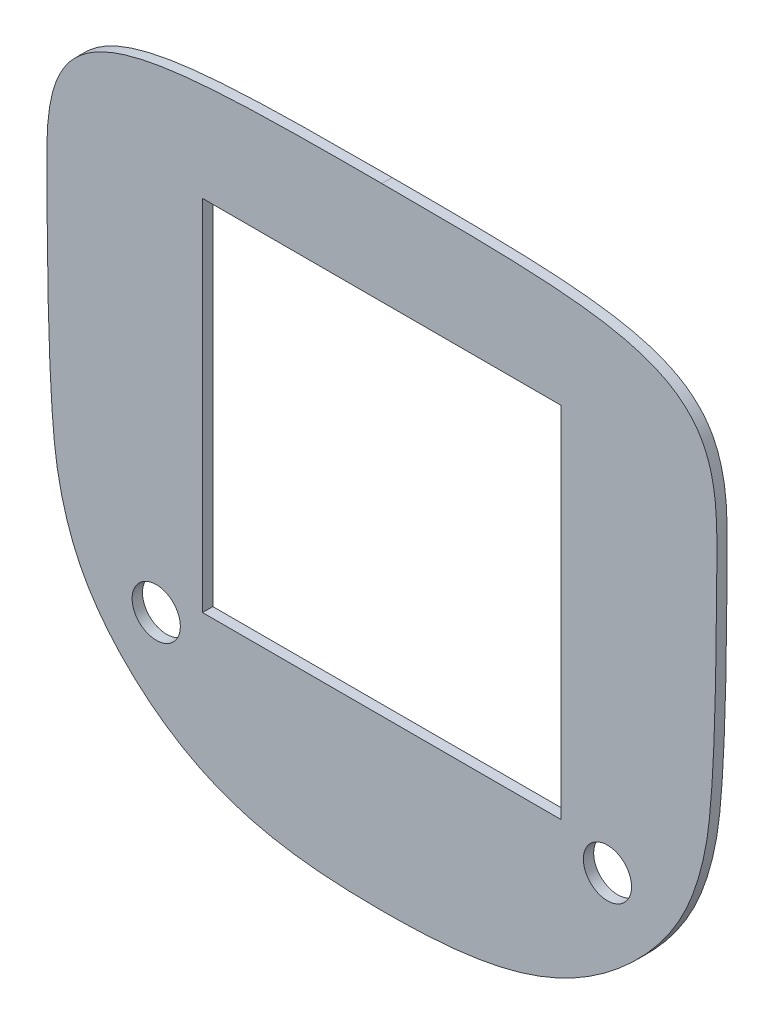
from build123d import *

# Parameters (mm, degrees)
SKETCH1_R           = 7
SKETCH1_R_2         = 7.000000001
SKETCH1_W           = 104.14
SKETCH1_H           = 104.14
BOSS_EXTRUDE1_DEPTH = 3


with BuildPart() as part:
    # Sketch1 → Boss-Extrude1 (new body)
    with BuildSketch(Plane(origin=(0, 0, 100), x_dir=(-1, 0, 0), z_dir=(0, 0, -1))):
        with BuildLine():
            add(Edge.make_bspline(
                [(-1e-09, -73.137085013), (-3.370733736, -73.137085013), (-6.734378943, -73.083771669), (-13.440672959, -72.819229501), (-16.783433063, -72.608837747), (-23.439182049, -71.964142651), (-26.752144152, -71.529637912), (-33.33759261, -70.356207321), (-36.60997649, -69.616510751), (-40.667378232, -68.443107129), (-41.477203817, -68.195980803), (-43.093366771, -67.675493026), (-43.900822122, -67.401729181), (-46.310032737, -66.541796001), (-47.889238607, -65.92044891), (-52.544477218, -63.909421833), (-55.537048564, -62.370824761), (-61.306337859, -58.908491373), (-64.084452162, -56.98724652), (-67.427542086, -54.354533899), (-68.090122652, -53.815906347), (-69.393533804, -52.722974051), (-70.035477989, -52.167844506), (-71.932790396, -50.47714376), (-73.159826692, -49.316427503), (-76.728035335, -45.734077875), (-78.958878587, -43.214525591), (-82.039575544, -39.199501195), (-83.021440244, -37.821191048), (-84.88412339, -34.974890516), (-85.767427654, -33.501005365), (-88.204559187, -29.023741799), (-89.563400092, -25.942835856), (-91.239794175, -21.190749213), (-91.74457302, -19.587205428), (-92.660442382, -16.346272129), (-93.069699195, -14.708220172), (-93.795158786, -11.398499673), (-94.111800727, -9.722957871), (-94.651697476, -6.365781752), (-94.87676845, -4.6830068), (-95.239286804, -1.309281941), (-95.39057167, 0.380376979), (-95.667624115, 3.762075486), (-95.789769063, 5.454453052), (-96.006949572, 8.841737387), (-96.101559279, 10.536683887), (-96.275518719, 13.928000585), (-96.3541526, 15.624404776), (-96.567849925, 20.713768319), (-96.680733557, 24.107568552), (-96.953354403, 34.290958559), (-97.04588188, 41.082678484), (-97.149341973, 51.270007833), (-97.178486911, 54.665842901), (-97.227652976, 59.759535712), (-97.245834664, 61.457370788), (-97.286778342, 64.853283992), (-97.310325044, 66.551469151), (-97.290358192, 69.942854821), (-97.255875699, 71.636726618), (-97.09582269, 75.017699558), (-96.972551619, 76.704971621), (-96.585320654, 80.06905822), (-96.320360567, 81.745798411), (-95.854782835, 83.831735242), (-95.754841059, 84.248415208), (-95.539629218, 85.080635775), (-95.424100672, 85.496934333), (-95.054796974, 86.733533), (-94.777904174, 87.544024069), (-93.84392333, 89.928683353), (-93.083697513, 91.456112273), (-91.917347528, 93.267482281), (-91.672560415, 93.6258059), (-91.167018785, 94.323599626), (-90.905778308, 94.663945051), (-90.097205711, 95.659890217), (-89.525112782, 96.290490077), (-88.317187597, 97.487335056), (-87.6813056, 98.053529952), (-86.682325789, 98.857229484), (-86.341828077, 99.117552429), (-85.646278974, 99.623504122), (-85.290309402, 99.869702545), (-83.492108358, 101.054683185), (-81.989735399, 101.864008562), (-78.891787842, 103.280138886), (-77.295448939, 103.885283055), (-74.849929741, 104.68215643), (-74.025694859, 104.929450071), (-72.377789623, 105.387657064), (-71.552081134, 105.599261026), (-69.070517041, 106.189836208), (-67.410275941, 106.525100239), (-64.081531041, 107.113279731), (-62.412948454, 107.365409975), (-57.397851787, 108.028626666), (-54.042298135, 108.349622004), (-47.317214164, 108.852316963), (-43.947594988, 109.033131006), (-37.200013677, 109.311610648), (-33.821984223, 109.408605309), (-27.060918817, 109.552698361), (-23.677806003, 109.599487384), (-13.530472118, 109.696626212), (-6.765261961, 109.705627481), (0, 109.705627484)],
                knots=[0, 0, 0, 0, 0.03125, 0.03125, 0.0625, 0.0625, 0.09375, 0.09375, 0.125, 0.125, 0.1328125, 0.1328125, 0.140625, 0.140625, 0.15625, 0.15625, 0.1875, 0.1875, 0.21875, 0.21875, 0.2265625, 0.2265625, 0.234375, 0.234375, 0.25, 0.25, 0.28125, 0.28125, 0.296875, 0.296875, 0.3125, 0.3125, 0.34375, 0.34375, 0.359375, 0.359375, 0.375, 0.375, 0.390625, 0.390625, 0.40625, 0.40625, 0.421875, 0.421875, 0.4375, 0.4375, 0.453125, 0.453125, 0.46875, 0.46875, 0.5, 0.5, 0.5625, 0.5625, 0.59375, 0.59375, 0.609375, 0.609375, 0.625, 0.625, 0.640625, 0.640625, 0.65625, 0.65625, 0.671875, 0.671875, 0.67578125, 0.67578125, 0.6796875, 0.6796875, 0.6875, 0.6875, 0.703125, 0.703125, 0.70703125, 0.70703125, 0.7109375, 0.7109375, 0.71875, 0.71875, 0.7265625, 0.7265625, 0.73046875, 0.73046875, 0.734375, 0.734375, 0.75, 0.75, 0.765625, 0.765625, 0.7734375, 0.7734375, 0.78125, 0.78125, 0.796875, 0.796875, 0.8125, 0.8125, 0.84375, 0.84375, 0.875, 0.875, 0.90625, 0.90625, 0.9375, 0.9375, 1, 1, 1, 1], degree=3))
            add(Edge.make_bspline(
                [(-1e-09, -73.137085013), (3.370733735, -73.137085013), (6.734378942, -73.083771669), (13.440672958, -72.819229501), (16.783433062, -72.608837747), (23.439182048, -71.964142651), (26.752144151, -71.529637912), (33.337592609, -70.356207322), (36.609976489, -69.616510752), (40.667378232, -68.44310713), (41.477203816, -68.195980803), (43.093366771, -67.675493027), (43.900822121, -67.401729181), (46.310032736, -66.541796001), (47.889238606, -65.920448911), (52.544477218, -63.909421834), (55.537048563, -62.370824761), (61.306337859, -58.908491374), (64.084452162, -56.98724652), (67.427542085, -54.3545339), (68.090122651, -53.815906348), (69.393533803, -52.722974052), (70.035477989, -52.167844506), (71.932790395, -50.47714376), (73.159826692, -49.316427504), (76.728035334, -45.734077876), (78.958878587, -43.214525592), (82.039575543, -39.199501196), (83.021440244, -37.821191049), (84.884123389, -34.974890517), (85.767427654, -33.501005366), (88.204559186, -29.0237418), (89.563400092, -25.942835857), (91.239794175, -21.190749214), (91.74457302, -19.58720543), (92.660442382, -16.34627213), (93.069699195, -14.708220173), (93.795158786, -11.398499674), (94.111800727, -9.722957872), (94.651697476, -6.365781754), (94.87676845, -4.683006801), (95.239286804, -1.309281942), (95.39057167, 0.380376978), (95.667624115, 3.762075485), (95.789769063, 5.454453051), (96.006949572, 8.841737385), (96.101559279, 10.536683886), (96.275518719, 13.928000584), (96.3541526, 15.624404775), (96.567849925, 20.713768318), (96.680733557, 24.107568551), (96.953354403, 34.290958558), (97.04588188, 41.082678483), (97.149341974, 51.270007832), (97.178486911, 54.6658429), (97.227652977, 59.759535711), (97.245834665, 61.457370787), (97.286778343, 64.853283991), (97.310325044, 66.55146915), (97.290358192, 69.94285482), (97.2558757, 71.636726617), (97.095822691, 75.017699557), (96.97255162, 76.70497162), (96.585320655, 80.069058219), (96.320360568, 81.74579841), (95.854782836, 83.83173524), (95.75484106, 84.248415207), (95.539629219, 85.080635774), (95.424100673, 85.496934331), (95.054796975, 86.733532999), (94.777904175, 87.544024068), (93.843923331, 89.928683352), (93.083697514, 91.456112272), (91.91734753, 93.26748228), (91.672560416, 93.625805898), (91.167018786, 94.323599625), (90.905778309, 94.66394505), (90.097205713, 95.659890216), (89.525112783, 96.290490076), (88.317187599, 97.487335055), (87.681305601, 98.053529951), (86.682325791, 98.857229483), (86.341828078, 99.117552428), (85.646278975, 99.623504121), (85.290309403, 99.869702544), (83.492108359, 101.054683184), (81.9897354, 101.864008561), (78.891787843, 103.280138886), (77.29544894, 103.885283054), (74.849929743, 104.682156429), (74.025694861, 104.92945007), (72.377789624, 105.387657063), (71.552081135, 105.599261025), (69.070517043, 106.189836207), (67.410275942, 106.525100238), (64.081531042, 107.11327973), (62.412948455, 107.365409974), (57.397851788, 108.028626665), (54.042298136, 108.349622003), (47.317214166, 108.852316963), (43.947594989, 109.033131006), (37.200013679, 109.311610647), (33.821984224, 109.408605308), (27.060918818, 109.55269836), (23.677806004, 109.599487383), (13.530472119, 109.696626212), (6.765261962, 109.705627481), (0, 109.705627484)],
                knots=[0, 0, 0, 0, 0.03125, 0.03125, 0.0625, 0.0625, 0.09375, 0.09375, 0.125, 0.125, 0.1328125, 0.1328125, 0.140625, 0.140625, 0.15625, 0.15625, 0.1875, 0.1875, 0.21875, 0.21875, 0.2265625, 0.2265625, 0.234375, 0.234375, 0.25, 0.25, 0.28125, 0.28125, 0.296875, 0.296875, 0.3125, 0.3125, 0.34375, 0.34375, 0.359375, 0.359375, 0.375, 0.375, 0.390625, 0.390625, 0.40625, 0.40625, 0.421875, 0.421875, 0.4375, 0.4375, 0.453125, 0.453125, 0.46875, 0.46875, 0.5, 0.5, 0.5625, 0.5625, 0.59375, 0.59375, 0.609375, 0.609375, 0.625, 0.625, 0.640625, 0.640625, 0.65625, 0.65625, 0.671875, 0.671875, 0.67578125, 0.67578125, 0.6796875, 0.6796875, 0.6875, 0.6875, 0.703125, 0.703125, 0.70703125, 0.70703125, 0.7109375, 0.7109375, 0.71875, 0.71875, 0.7265625, 0.7265625, 0.73046875, 0.73046875, 0.734375, 0.734375, 0.75, 0.75, 0.765625, 0.765625, 0.7734375, 0.7734375, 0.78125, 0.78125, 0.796875, 0.796875, 0.8125, 0.8125, 0.84375, 0.84375, 0.875, 0.875, 0.90625, 0.90625, 0.9375, 0.9375, 1, 1, 1, 1], degree=3))
        make_face()
        with Locations((-65.5, -30.887752409)):
            Circle(SKETCH1_R, mode=Mode.SUBTRACT)
        with Locations(Location((65.5, -30.887752409, 0), (0, 0, 180))):
            Circle(SKETCH1_R_2, mode=Mode.SUBTRACT)
        with Locations((0, 27.871196428)):
            Rectangle(SKETCH1_W, SKETCH1_H, mode=Mode.SUBTRACT)
    extrude(amount=BOSS_EXTRUDE1_DEPTH)


solid = part.part
